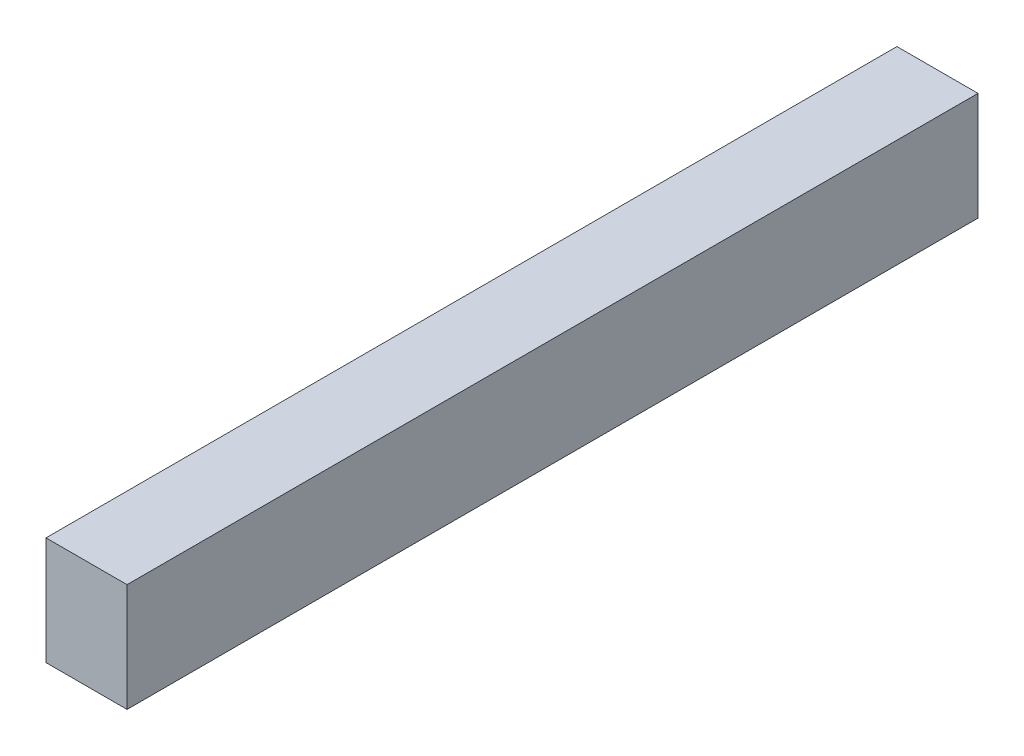
from build123d import *

# Parameters (mm, degrees)
SKETCH1_W           = 4.7625
SKETCH1_H           = 6.35
BOSS_EXTRUDE1_DEPTH = 50


with BuildPart() as part:
    # Sketch1 → Boss-Extrude1 (new body)
    with BuildSketch(Plane.XY):
        with Locations((-15.860902466, 7.721860987)):
            Rectangle(SKETCH1_W, SKETCH1_H)
    extrude(amount=BOSS_EXTRUDE1_DEPTH)


solid = part.part
